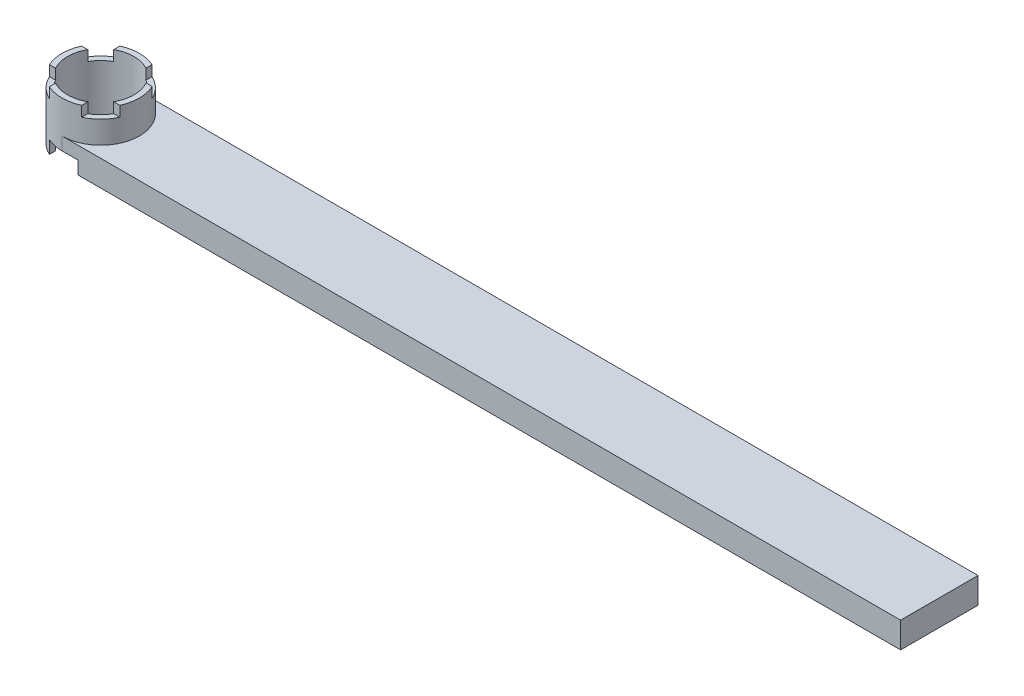
from build123d import *
from build123d.topology import SkipClean

# Parameters (mm, degrees)
SKETCH_1_R          = 6
SKETCH_1_R_2        = 5.15
EXTRUDE_3_DEPTH     = 4
SKETCH_2_R          = 6
SKETCH_2_R_2        = 5.15
EXTRUDE_4_DEPTH     = 3.5
CUT_EXTRUDE_1_DEPTH = 2
EXTRUDE_5_DEPTH     = 1.6


with BuildPart() as part:
    # 草图1 → 凸台-拉伸3 (new body)
    # profile 1 of 2: a face of its own
    with BuildSketch(Plane(origin=(0, 0, 0), x_dir=(1, 0, 0), z_dir=(0, 1, 0))):
        with BuildLine():
            Line((130, 6), (0, 6))
            ThreePointArc((0, 6), (4.242640687, 4.242640687), (6, 0))
            ThreePointArc((6, 0), (4.242640687, -4.242640687), (0, -6))
            Line((0, -6), (130, -6))
            Line((130, -6), (130, 6))
        make_face()
    # profile 2 of 2: a face of its own
    with BuildSketch(Plane(origin=(0, 0, 0), x_dir=(1, 0, 0), z_dir=(0, 1, 0))):
        Circle(SKETCH_1_R)
        with Locations(Location((0, 0, 0), (0, 0, 270))):
            Circle(SKETCH_1_R_2, mode=Mode.SUBTRACT)
    extrude(amount=EXTRUDE_3_DEPTH)

    # 草图2 → 凸台-拉伸4 (add)
    with BuildSketch(Plane(origin=(0, 4, 0), x_dir=(1, 0, 0), z_dir=(0, 1, 0))):
        with Locations(Location((0, 0, 0), (0, 0, 270))):
            Circle(SKETCH_2_R)
        with Locations(Location((0, 0, 0), (0, 0, 270))):
            Circle(SKETCH_2_R_2, mode=Mode.SUBTRACT)
    extrude(amount=EXTRUDE_4_DEPTH)

    # 草图3 → 切除-拉伸1 (cut)
    with BuildSketch(Plane.XZ):
        Polygon((-2.5, -8.5), (2.5, -8.5), (2.5, -2.5), (6, -2.5), (6, 2.5), (2.5, 2.5), (2.5, 8.5), (-2.5, 8.5), (-2.5, 2.5), (-6, 2.5), (-6, -2.5), (-2.5, -2.5), align=None)
    extrude(amount=-CUT_EXTRUDE_1_DEPTH, mode=Mode.SUBTRACT)

    # 草图4 → 凸台-拉伸5 (add)
    with SkipClean():  # the faces are left unmerged after this step: merging them gives an invalid solid
        with BuildSketch(Plane(origin=(0, 7.5, 0), x_dir=(1, 0, 0), z_dir=(0, 1, 0))):
            with BuildLine():
                ThreePointArc((-4.502499306, -2.5), (-5.15, 0), (-4.502499306, 2.5))
                Line((-4.502499306, 2.5), (-5.454356057, 2.5))
                ThreePointArc((-5.454356057, 2.5), (-6, 0), (-5.454356057, -2.5))
                Line((-5.454356057, -2.5), (-4.502499306, -2.5))
            make_face()
            with BuildLine():
                ThreePointArc((-2.5, 4.502499306), (0, 5.15), (2.5, 4.502499306))
                Line((2.5, 4.502499306), (2.5, 5.454356057))
                ThreePointArc((2.5, 5.454356057), (0, 6), (-2.5, 5.454356057))
                Line((-2.5, 5.454356057), (-2.5, 4.502499306))
            make_face()
            with BuildLine():
                Line((5.440505491, 2.53), (4.485710646, 2.53))
                ThreePointArc((4.485710646, 2.53), (4.981159997, 1.307878085), (5.15, 0))
                ThreePointArc((5.15, 0), (4.985497539, -1.291245247), (4.502499306, -2.5))
                Line((4.502499306, -2.5), (5.454356057, -2.5))
                ThreePointArc((5.454356057, -2.5), (5.862002062, -1.279426367), (6, 0))
                ThreePointArc((6, 0), (5.858456834, 1.295563015), (5.440505491, 2.53))
            make_face()
            with BuildLine():
                Line((2.5, -5.454356057), (2.5, -4.502499306))
                ThreePointArc((2.5, -4.502499306), (0, -5.15), (-2.5, -4.502499306))
                Line((-2.5, -4.502499306), (-2.5, -5.454356057))
                ThreePointArc((-2.5, -5.454356057), (0, -6), (2.5, -5.454356057))
            make_face()
        extrude(amount=EXTRUDE_5_DEPTH)


solid = part.part
